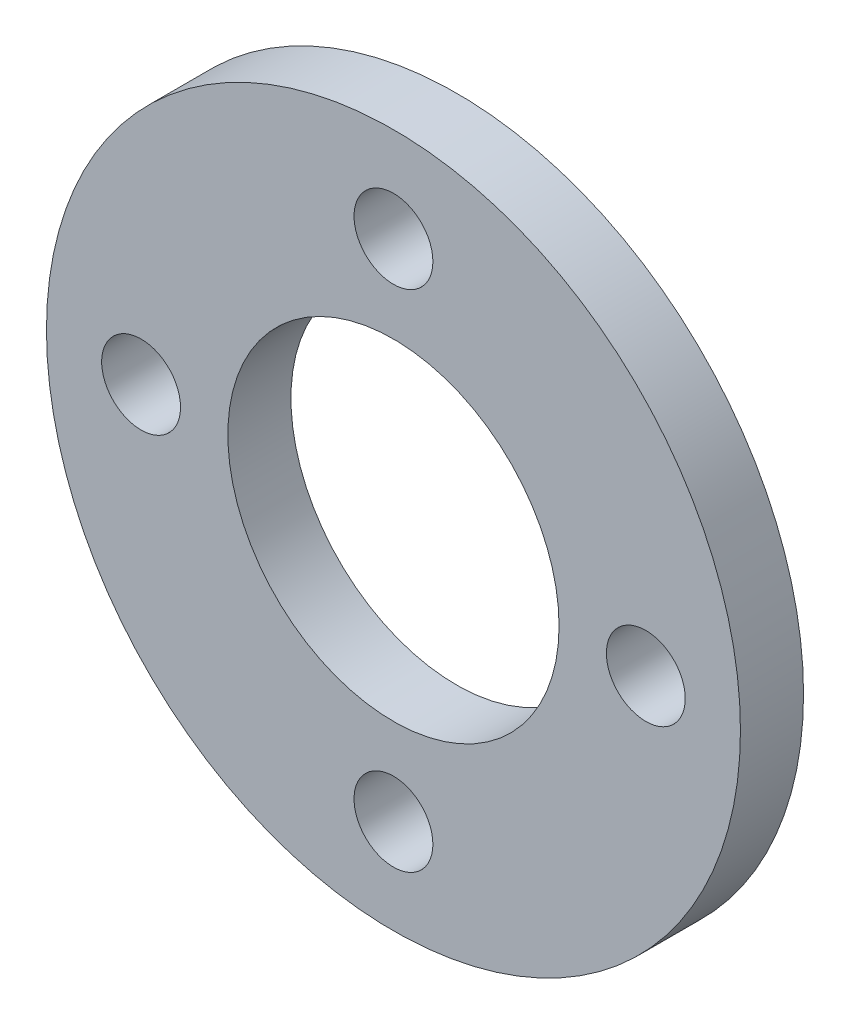
from build123d import *

# Parameters (mm, degrees)
SKETCH_1_R      = 11
SKETCH_1_R_2    = 5.25
SKETCH_1_R_3    = 1.25
EXTRUDE_1_DEPTH = 2


with BuildPart() as part:
    # 草图1 → 凸台-拉伸1 (new body)
    with BuildSketch(Plane.XY):
        Circle(SKETCH_1_R)
        Circle(SKETCH_1_R_2, mode=Mode.SUBTRACT)
        with Locations((0, 8)):
            Circle(SKETCH_1_R_3, mode=Mode.SUBTRACT)
        with Locations((8, 0)):
            Circle(SKETCH_1_R_3, mode=Mode.SUBTRACT)
        with Locations((0, -8)):
            Circle(SKETCH_1_R_3, mode=Mode.SUBTRACT)
        with Locations((-8, 0)):
            Circle(SKETCH_1_R_3, mode=Mode.SUBTRACT)
    extrude(amount=EXTRUDE_1_DEPTH)


solid = part.part
